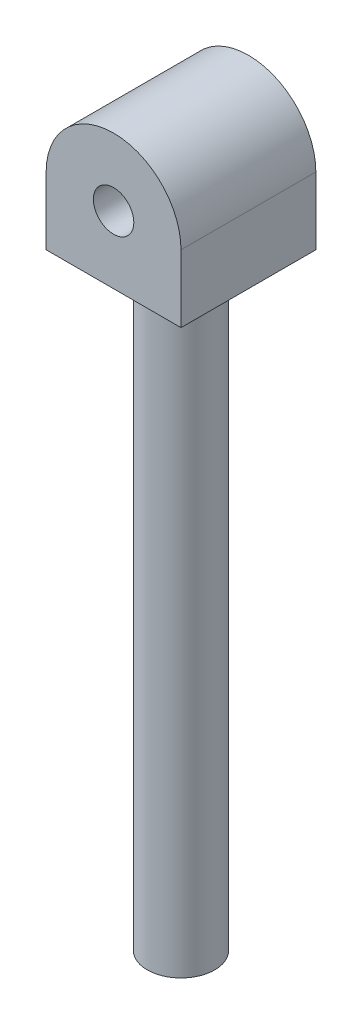
from build123d import *

# Parameters (mm, degrees)
CROQUIS1_R              = 1.5
SALIENTE_EXTRUIR1_DEPTH = 10
CROQUIS2_R              = 2.5
SALIENTE_EXTRUIR2_DEPTH = 45


with BuildPart() as part:
    # Croquis1 → Saliente-Extruir1 (new body)
    with BuildSketch(Plane.XY):
        with BuildLine():
            Line((-5, 0), (-5, -5))
            Line((-5, -5), (5, -5))
            Line((5, -5), (5, 0))
            ThreePointArc((5, 0), (0, 5), (-5, 0))
        make_face()
        Circle(CROQUIS1_R, mode=Mode.SUBTRACT)
    extrude(amount=SALIENTE_EXTRUIR1_DEPTH)

    # Croquis2 → Saliente-Extruir2 (add)
    with BuildSketch(Plane.XZ.offset(5)):
        with Locations((0, 5)):
            Circle(CROQUIS2_R)
    extrude(amount=SALIENTE_EXTRUIR2_DEPTH)


solid = part.part
